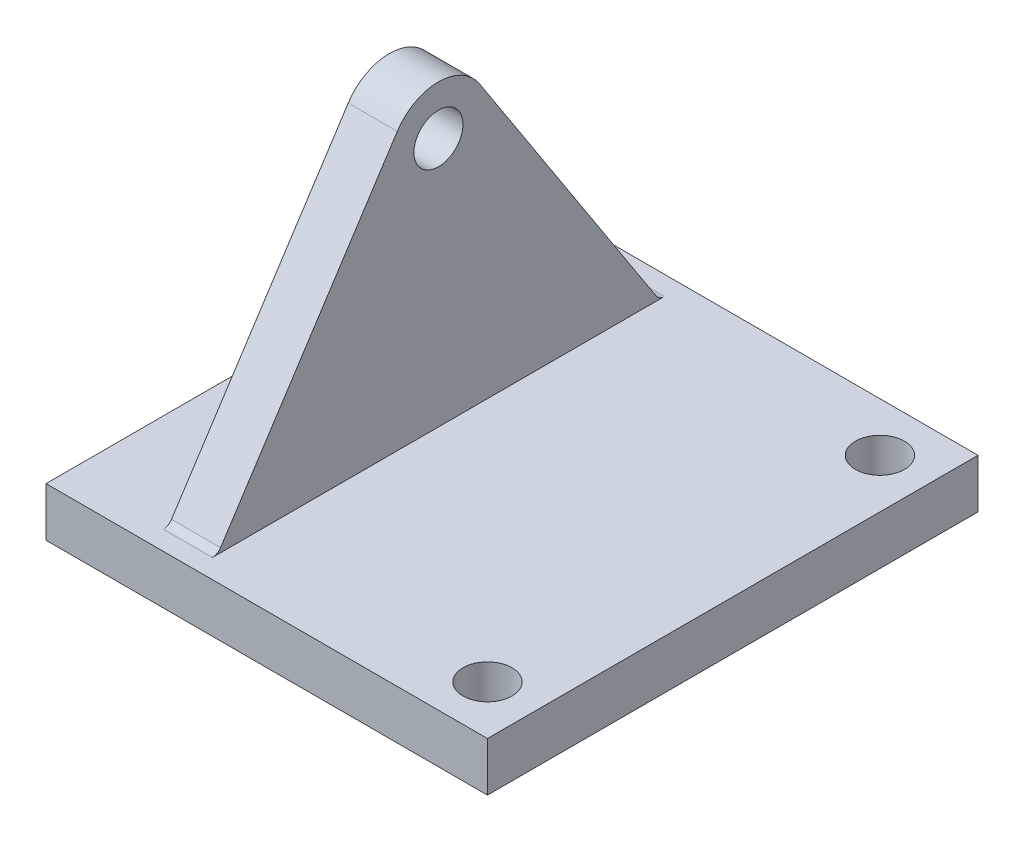
from build123d import *

# Parameters (mm, degrees)
SKETCH2_R                = 5
BOSS_EXTRUDE1_DEPTH      = 10
BOSS_EXTRUDE2_DEPTH      = 70
BOSS_EXTRUDE2_DEPTH_BACK = 20
SKETCH3_R                = 5
CUT_EXTRUDE1_DEPTH       = 5
FILLET1_R                = 2


with BuildPart() as part:
    # Sketch2 → Boss-Extrude1 (new body)
    with BuildSketch(Plane(origin=(0, 0, 0), x_dir=(0, 0, -1), z_dir=(1, 0, 0))):
        with BuildLine():
            Line((-8.38684039, 61.382374771), (-45, 5))
            Line((-45, 5), (45, 5))
            Line((45, 5), (8.38684039, 61.382374771))
            ThreePointArc((8.38684039, 61.382374771), (0, 65.936191862), (-8.38684039, 61.382374771))
        make_face()
        with Locations((0, 55.936191862)):
            Circle(SKETCH2_R, mode=Mode.SUBTRACT)
    extrude(amount=BOSS_EXTRUDE1_DEPTH)

    # Sketch2<3> → Boss-Extrude2 (add, two sides: drawn at the far end of the back side and taken through both)
    with BuildSketch(Plane(origin=(0, 0, 0), x_dir=(0, 0, -1), z_dir=(1, 0, 0)).offset(-BOSS_EXTRUDE2_DEPTH_BACK)):
        Polygon((-50, 5), (-50, -5), (50, -5), (50, 5), (45, 5), (-45, 5), align=None)
    extrude(amount=BOSS_EXTRUDE2_DEPTH + BOSS_EXTRUDE2_DEPTH_BACK)

    # Sketch3 → Cut-Extrude1 (cut, symmetric)
    with BuildSketch(Plane(origin=(0, 0, 0), x_dir=(1, 0, 0), z_dir=(0, 1, 0))):
        with Locations((60, 40)):
            Circle(SKETCH3_R)
        with Locations((60, -40)):
            Circle(SKETCH3_R)
    extrude(amount=CUT_EXTRUDE1_DEPTH, both=True, mode=Mode.SUBTRACT)

    # Fillet1
    fillet1_edges = [part.edges().sort_by_distance(p)[0] for p in [
        (5, 5, 45),
        (5, 5, -45),
    ]]
    fillet(fillet1_edges, radius=FILLET1_R)


solid = part.part
